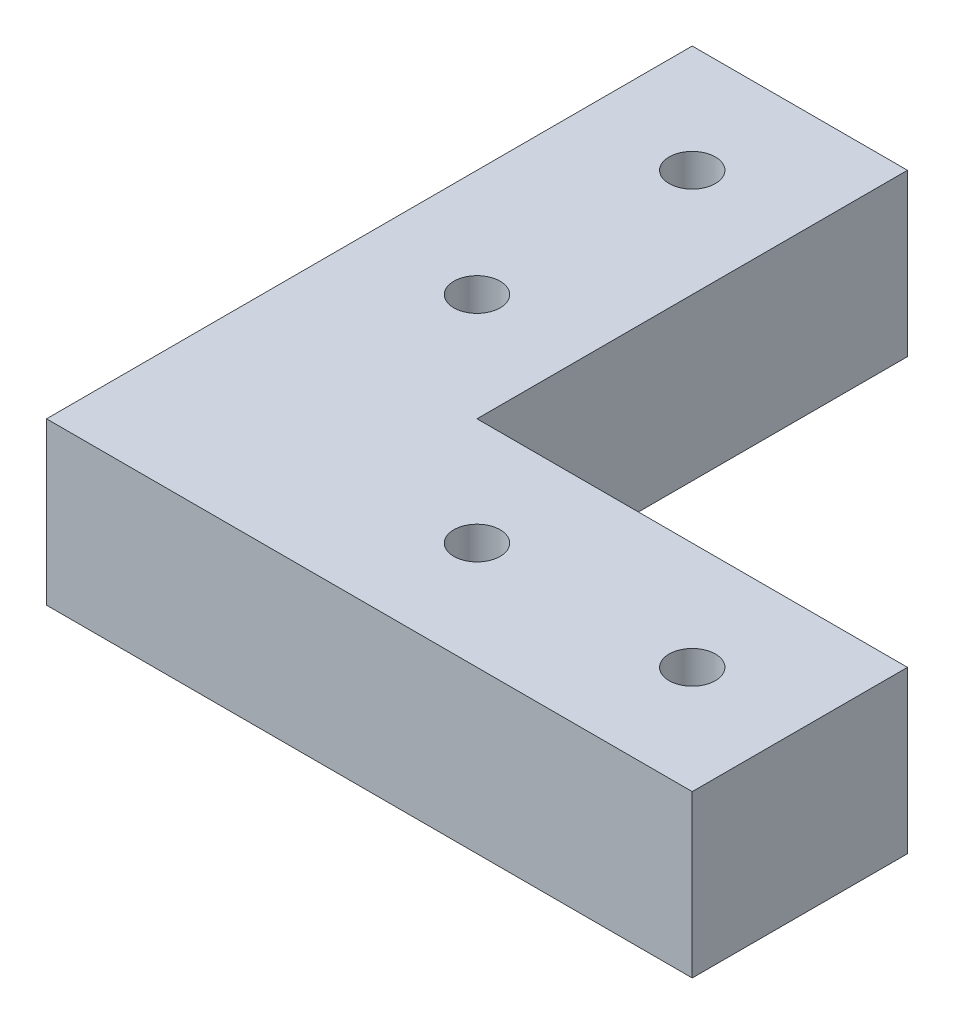
from build123d import *

# Parameters (mm, degrees)
SKETCH1_R           = 2.15
BOSS_EXTRUDE1_DEPTH = 15


with BuildPart() as part:
    # Sketch1 → Boss-Extrude1 (new body)
    with BuildSketch(Plane(origin=(0, 0, 0), x_dir=(1, 0, 0), z_dir=(0, 1, 0))):
        Polygon((0, 0), (60, 0), (60, 20), (20, 20), (20, 60), (0, 60), align=None)
        with Locations(Location((50, 10, 0), (0, 0, 270))):
            Circle(SKETCH1_R, mode=Mode.SUBTRACT)
        with Locations(Location((30, 10, 0), (0, 0, 270))):
            Circle(SKETCH1_R, mode=Mode.SUBTRACT)
        with Locations(Location((10, 50, 0), (0, 0, 270))):
            Circle(SKETCH1_R, mode=Mode.SUBTRACT)
        with Locations(Location((10, 30, 0), (0, 0, 270))):
            Circle(SKETCH1_R, mode=Mode.SUBTRACT)
    extrude(amount=BOSS_EXTRUDE1_DEPTH)


solid = part.part
